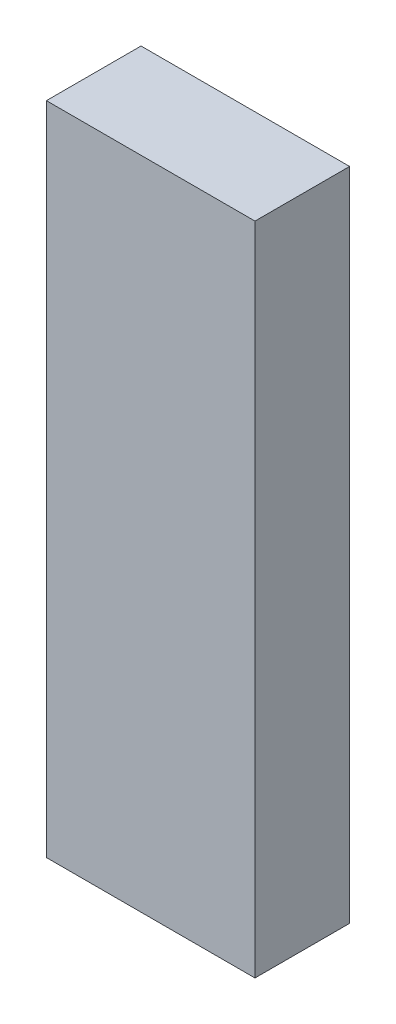
from build123d import *

# Parameters (mm, degrees)
SKETCH1_W           = 54
SKETCH1_H           = 24.5
BOSS_EXTRUDE1_DEPTH = 169.7


with BuildPart() as part:
    # Sketch1 → Boss-Extrude1 (new body)
    with BuildSketch(Plane(origin=(0, 0, 0), x_dir=(1, 0, 0), z_dir=(0, 1, 0))):
        with Locations((27, 12.25)):
            Rectangle(SKETCH1_W, SKETCH1_H)
    extrude(amount=BOSS_EXTRUDE1_DEPTH)


solid = part.part
